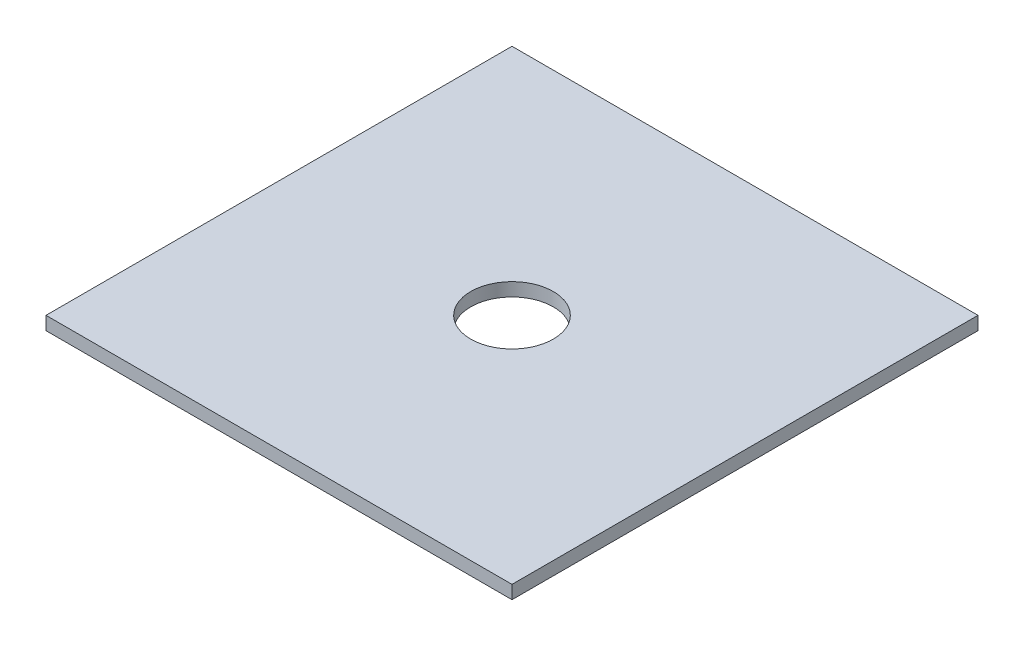
from build123d import *

# Parameters (mm, degrees)
SKETCH2_W                = 35
SKETCH2_H                = 35
BOSS_EXTRUDE1_DEPTH      = 10
SKETCH3_W                = 35
SKETCH3_H                = 35
SKETCH3_W_2              = 25
SKETCH3_H_2              = 25
BOSS_EXTRUDE2_DEPTH      = 15
SKETCH4_W                = 35
SKETCH4_H                = 35
BOSS_EXTRUDE3_DEPTH      = 15
CUT_EXTRUDE1_START       = -40
SKETCH5_R                = 3.05
CUT_EXTRUDE1_DEPTH       = 40
BOSS_EXTRUDE4_DEPTH      = 10
BOSS_EXTRUDE4_DEPTH_BACK = 40
SKETCH6_W                = 7.5
SKETCH6_H                = 1.017843133
SKETCH6_H_2              = 1.2761833
SKETCH7_R                = 2.76
CUT_EXTRUDE2_DEPTH       = 10
SKETCH8_W                = 35
SKETCH8_H                = 35
BOSS_EXTRUDE5_DEPTH      = 1
SKETCH9_R                = 3.1
CUT_EXTRUDE3_DEPTH       = 1


with BuildPart() as part:
    # Sketch2 → Boss-Extrude1 (new body)
    with BuildSketch(Plane(origin=(0, 0, 0), x_dir=(1, 0, 0), z_dir=(0, 1, 0))):
        Rectangle(SKETCH2_W, SKETCH2_H)
    extrude(amount=BOSS_EXTRUDE1_DEPTH)


with BuildPart() as body_2:
    # Sketch3 → Boss-Extrude2 (new body)
    with BuildSketch(Plane(origin=(0, 10, 0), x_dir=(1, 0, 0), z_dir=(0, 1, 0))):
        Rectangle(SKETCH3_W, SKETCH3_H)
        Rectangle(SKETCH3_W_2, SKETCH3_H_2, mode=Mode.SUBTRACT)
    extrude(amount=BOSS_EXTRUDE2_DEPTH)


with BuildPart() as body_3:
    # Sketch4 → Boss-Extrude3 (new body)
    with BuildSketch(Plane(origin=(0, 25, 0), x_dir=(1, 0, 0), z_dir=(0, 1, 0))):
        Rectangle(SKETCH4_W, SKETCH4_H)
    extrude(amount=BOSS_EXTRUDE3_DEPTH)


with BuildPart() as cut_extrude1_tool:
    # Sketch5 → Cut-Extrude1 (new body)
    with BuildSketch(Plane(origin=(0, 40, 0), x_dir=(1, 0, 0), z_dir=(0, 1, 0)).offset(CUT_EXTRUDE1_START)):
        with Locations(Location((0, 0, 0), (0, 0, 270))):
            Circle(SKETCH5_R)
    extrude(amount=CUT_EXTRUDE1_DEPTH)


with BuildPart() as part_1:
    add(part.part)

    # Cut-Extrude1: cut by cut_extrude1_tool
    add(cut_extrude1_tool.part, mode=Mode.SUBTRACT)


with BuildPart() as body_3_1:
    add(body_3.part)

    # Cut-Extrude1: cut by cut_extrude1_tool
    add(cut_extrude1_tool.part, mode=Mode.SUBTRACT)

    # Sketch6 → Boss-Extrude4 (add, two sides: drawn at the far end of the back side and taken through both)
    with BuildSketch(Plane(origin=(0, 0, -17.5), x_dir=(-1, 0, 0), z_dir=(0, 0, -1)).offset(-BOSS_EXTRUDE4_DEPTH_BACK)):
        with Locations((-13.75, 25.508921566)):
            Rectangle(SKETCH6_W, SKETCH6_H)
        with Locations((13.75, 25.63809165)):
            Rectangle(SKETCH6_W, SKETCH6_H_2)
    extrude(amount=BOSS_EXTRUDE4_DEPTH + BOSS_EXTRUDE4_DEPTH_BACK)

    # Sketch7 → Cut-Extrude2 (cut)
    with BuildSketch(Plane(origin=(0, 26.2761833, 0), x_dir=(1, 0, 0), z_dir=(0, 1, 0))):
        with Locations(Location((-13.75, 22.5, 0), (0, 0, 270))):
            Circle(SKETCH7_R)
        with Locations((8.75, 22.5)):
            Circle(SKETCH7_R)
        with Locations((8.75, -18)):
            Circle(SKETCH7_R)
        with Locations(Location((-13.75, -18, 0), (0, 0, 270))):
            Circle(SKETCH7_R)
    extrude(amount=-CUT_EXTRUDE2_DEPTH, mode=Mode.SUBTRACT)


with BuildPart() as body_2_2:
    # Sketch8 → Boss-Extrude5 (new body)
    with BuildSketch(Plane(origin=(0, 40, 0), x_dir=(1, 0, 0), z_dir=(0, 1, 0))):
        Rectangle(SKETCH8_W, SKETCH8_H)
    extrude(amount=BOSS_EXTRUDE5_DEPTH)

    # Sketch9 → Cut-Extrude3 (cut)
    with BuildSketch(Plane(origin=(0, 41, 0), x_dir=(1, 0, 0), z_dir=(0, 1, 0))):
        with Locations(Location((0, 0, 0), (0, 0, 270))):
            Circle(SKETCH9_R)
    extrude(amount=-CUT_EXTRUDE3_DEPTH, mode=Mode.SUBTRACT)


solid = body_2_2.part
